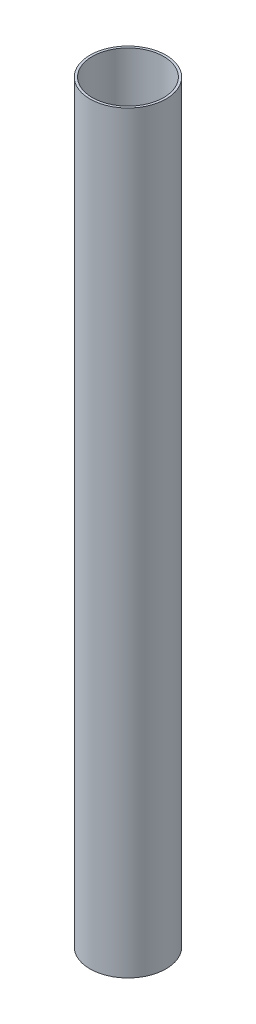
from build123d import *

# Parameters (mm, degrees)
SKETCH1_R           = 57.5
SKETCH1_R_2         = 54
BOSS_EXTRUDE1_DEPTH = 1140


with BuildPart() as part:
    # Sketch1 → Boss-Extrude1 (new body)
    with BuildSketch(Plane(origin=(0, 0, 0), x_dir=(1, 0, 0), z_dir=(0, 1, 0))):
        with Locations(Location((0, 0, 0), (0, 0, 270))):
            Circle(SKETCH1_R)
        with Locations(Location((0, 0, 0), (0, 0, 270))):
            Circle(SKETCH1_R_2, mode=Mode.SUBTRACT)
    extrude(amount=BOSS_EXTRUDE1_DEPTH)


solid = part.part
